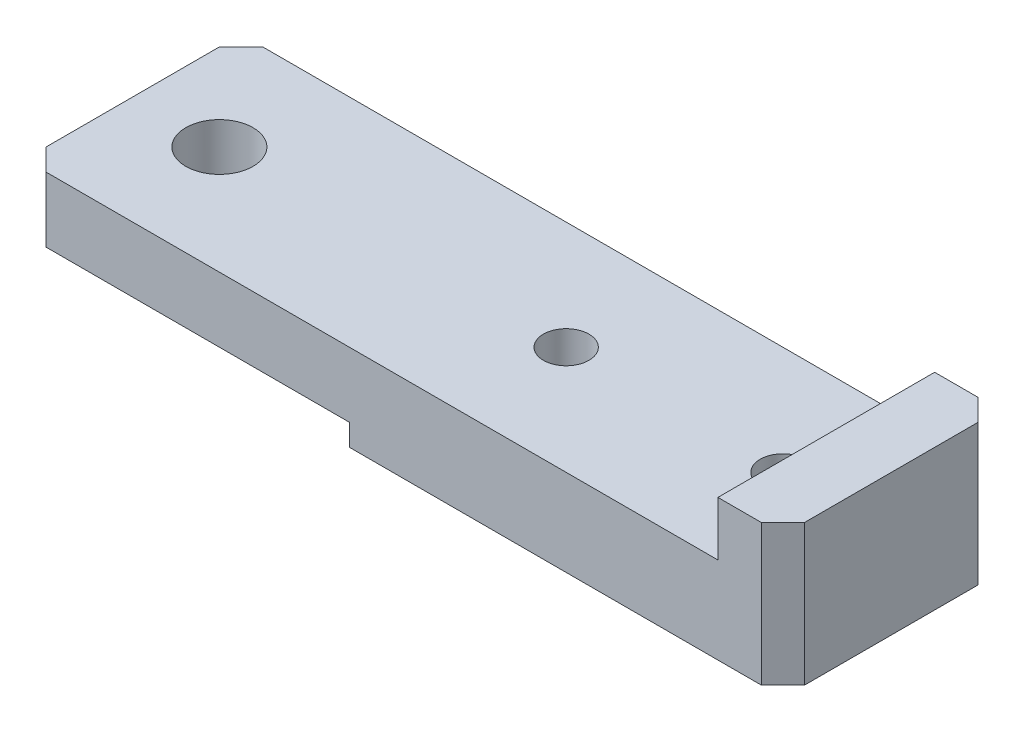
from build123d import *

# Parameters (mm, degrees)
EXTRUDE_1_DEPTH     = 10
SKETCH_3_R          = 5
EXTRUDE_2_DEPTH     = 2
CHAMFER_1_SIZE      = 2
CHAMFER_2_SIZE      = 2
SKETCH_4_R          = 2.1
SKETCH_4_R_2        = 3.1
CUT_EXTRUDE_1_DEPTH = 72.895757872
FILLET_1_R          = 1


with BuildPart() as part:
    # 草图1 → 凸台-拉伸1 (new, symmetric)
    with BuildSketch(Plane.XY):
        Polygon((0, 4), (0, 10), (64, 10), (64, 15), (70, 15), (70, 10), (70, 2), (30, 2), (30, 4), align=None)
    extrude(amount=EXTRUDE_1_DEPTH, both=True)

    # 草图3 → 凸台-拉伸2 (add)
    with BuildSketch(Plane.XZ.offset(-4)):
        with Locations(Location((8, 0, 0), (0, 0, 90))):
            Circle(SKETCH_3_R)
    extrude(amount=EXTRUDE_2_DEPTH)

    # 倒角1
    chamfer_1_edges = [part.edges().sort_by_distance(p)[0] for p in [
        (0, 7, -10),
        (0, 7, 10),
    ]]
    chamfer(chamfer_1_edges, length=CHAMFER_1_SIZE)

    # 倒角2
    chamfer_2_edges = [part.edges().sort_by_distance(p)[0] for p in [
        (70, 8.5, 10),
        (70, 8.5, -10),
    ]]
    chamfer(chamfer_2_edges, length=CHAMFER_2_SIZE)

    # 草图4 → 切除-拉伸1 (cut, through all)
    with BuildSketch(Plane.XZ.offset(-2)):
        with Locations((40, 0)):
            Circle(SKETCH_4_R)
        with Locations((60, 0)):
            Circle(SKETCH_4_R)
        with Locations((8, 0)):
            Circle(SKETCH_4_R_2)
    extrude(amount=-CUT_EXTRUDE_1_DEPTH, mode=Mode.SUBTRACT)

    # 圆角1
    fillet_1_edges = [part.edges().sort_by_distance(p)[0] for p in [
        (8, 4, -5),
    ]]
    fillet(fillet_1_edges, radius=FILLET_1_R)


solid = part.part
